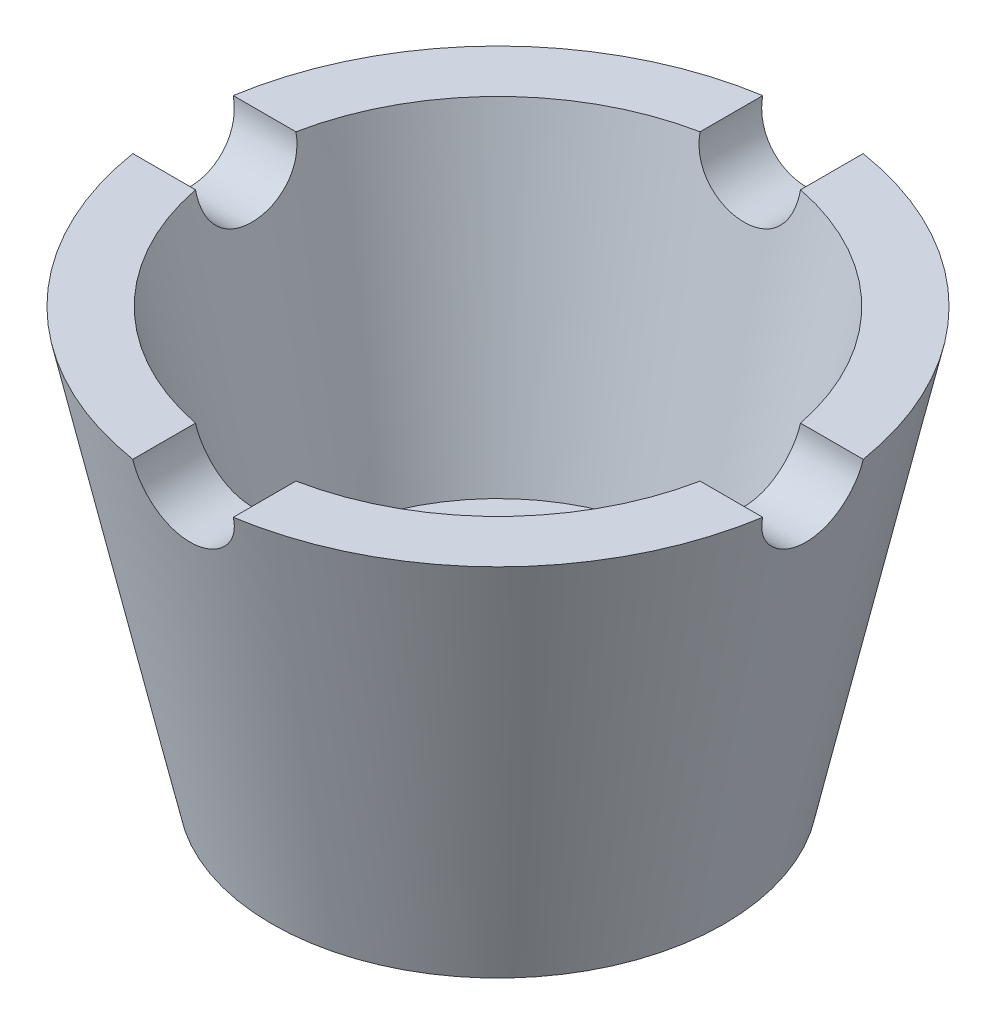
from build123d import *

# Parameters (mm, degrees)
SKETCH2_R          = 5
CUT_EXTRUDE1_DEPTH = 40
CIRPATTERN1_COUNT  = 4


with BuildPart() as part:
    # Sketch1 → Revolve1 (revolve)
    with BuildSketch(Plane.XY, mode=Mode.PRIVATE) as revolve1_sk:
        Polygon((11, 0), (22.5, 0), (31.753664233, 42), (25.609760166, 42), (19, 12), (11, 12), align=None)
    revolve(revolve1_sk.sketch.rotate(Axis((0, 0, 0), (0, 1, 0)), 90), axis=Axis((0, 0, 0), (0, 1, 0)))

    # Sketch2 → Cut-Extrude1 (cut, symmetric)
    with BuildSketch(Plane.XY):
        with Locations((0, 42)):
            Circle(SKETCH2_R)
    cut_extrude1 = extrude(amount=CUT_EXTRUDE1_DEPTH, both=True, mode=Mode.SUBTRACT)

    # CirPattern1: Cut-Extrude1 ×4 about axis
    cirpattern1_axis = Axis((0, 0, 0), (0, 1, 0))
    for i in range(1, CIRPATTERN1_COUNT):
        add(cut_extrude1.rotate(cirpattern1_axis, i * 360 / CIRPATTERN1_COUNT), mode=Mode.SUBTRACT)


solid = part.part
